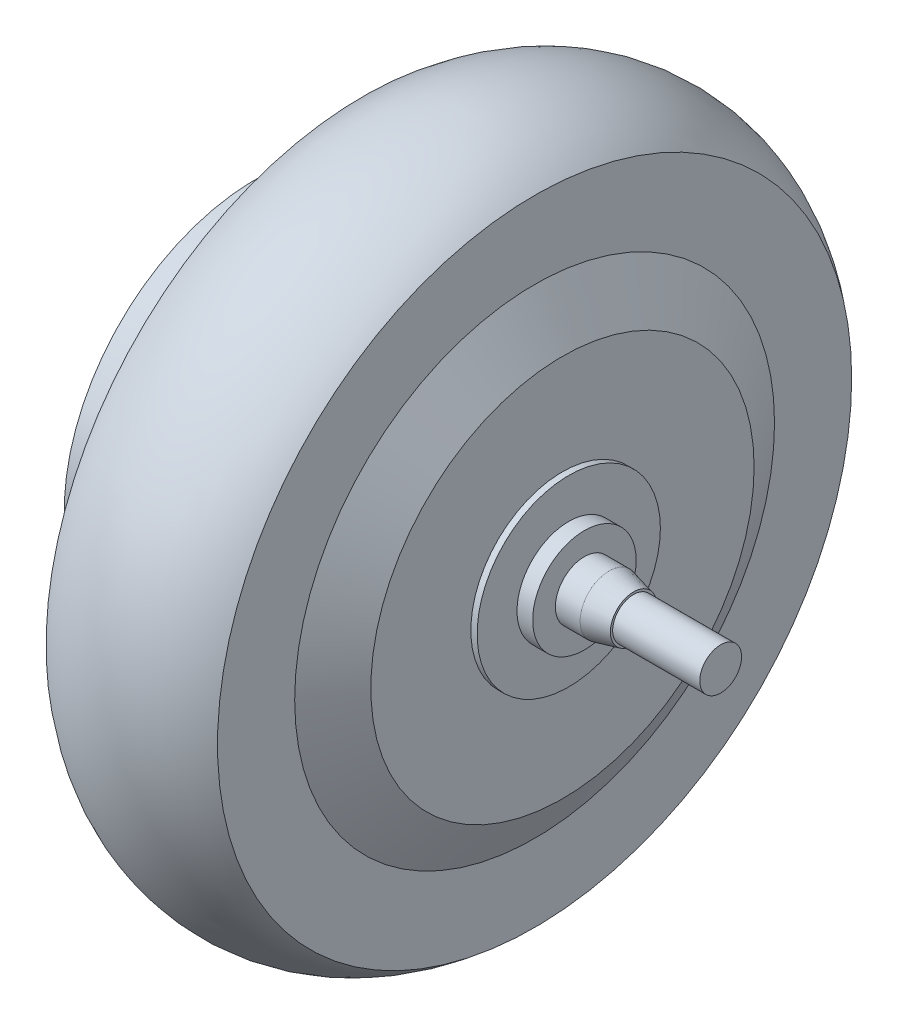
from build123d import *

# Parameters (mm, degrees)
SKETCH2_R           = 6.05
BOSS_EXTRUDE1_DEPTH = 5.6
SKETCH2_3_W         = 10.7
SKETCH2_3_H         = 16.7
BOSS_EXTRUDE2_DEPTH = 13.8


with BuildPart() as part:
    # Sketch1 → Revolve1 (revolve)
    with BuildSketch(Plane.XY):
        with BuildLine():
            Line((78, 0), (78, 6))
            Line((78, 6), (53, 6))
            Line((53, 6), (53, 6.65))
            Line((53, 6.65), (46, 8.35))
            Line((46, 8.35), (38.9, 8.35))
            Line((38.9, 8.35), (38.9, 14.85))
            Line((38.9, 14.85), (34.4, 14.85))
            Line((34.4, 14.85), (34.4, 26.3))
            Line((34.4, 26.3), (32.6, 26.3))
            Line((32.6, 26.3), (32.6, 55))
            Line((32.6, 55), (24.6, 68.856406461))
            Line((24.6, 68.856406461), (24.6, 91))
            ThreePointArc((24.6, 91), (0, 100), (-24.6, 91))
            Line((-24.6, 91), (-24.6, 68.856406461))
            Line((-24.6, 68.856406461), (-32.6, 55))
            Line((-32.6, 55), (-55.4, 55))
            Line((-55.4, 55), (-55.4, 11.25))
            Line((-55.4, 11.25), (-60.4, 11.25))
            Line((-60.4, 11.25), (-60.4, 6))
            Line((-60.4, 6), (-85.4, 6))
            Line((-85.4, 6), (-85.4, 0))
            Line((-85.4, 0), (78, 0))
        make_face()
    revolve(axis=Axis((0, 0, 0), (-1, 0, 0)))

    # Sketch2 → Boss-Extrude1 (add)
    with BuildSketch(Plane.ZY.offset(55.4)):
        with Locations((22.627416998, 22.627416998)):
            Circle(SKETCH2_R)
    extrude(amount=BOSS_EXTRUDE1_DEPTH)

    # Sketch2<3> → Boss-Extrude2 (add)
    with BuildSketch(Plane.ZY.offset(55.4)):
        with Locations((22.627416998, -26.372583002)):
            Rectangle(SKETCH2_3_W, SKETCH2_3_H)
    extrude(amount=BOSS_EXTRUDE2_DEPTH)


solid = part.part
